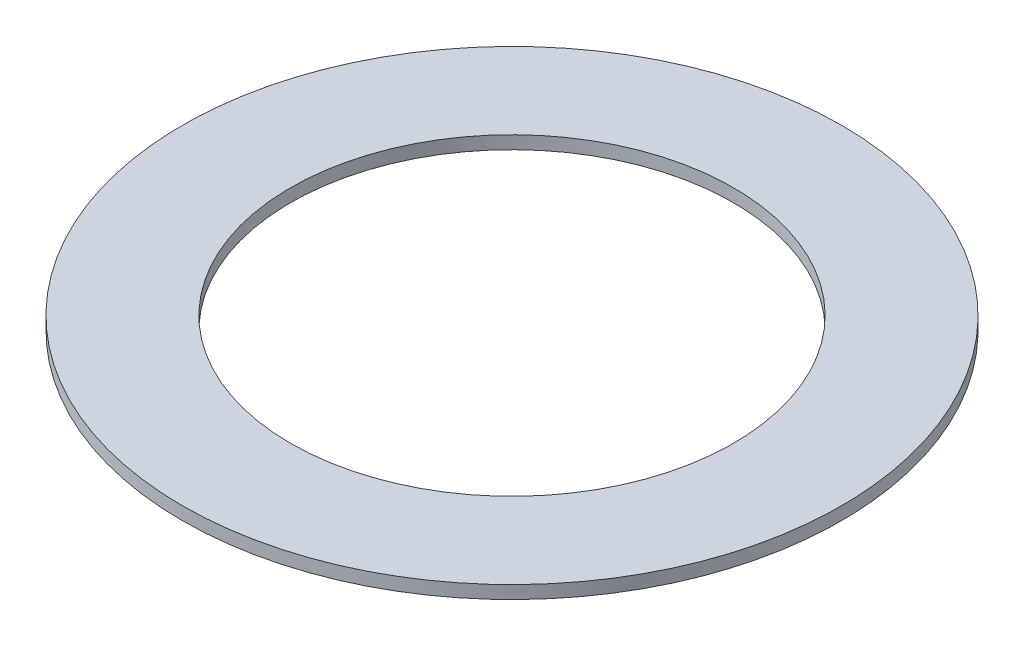
from build123d import *

# Parameters (mm, degrees)
BOSS_EXTRUDE1_DEPTH      = 1.5
BOSS_EXTRUDE1_DEPTH_BACK = 1.5
SKETCH1_R                = 76.2
SKETCH1_R_2              = 51.2


with BuildPart() as part:
    # Sketch1 → Boss-Extrude1 (new, two sides: drawn at the far end of the back side and taken through both)
    with BuildSketch(Plane(origin=(0, 0, 0), x_dir=(1, 0, 0), z_dir=(0, 1, 0)).offset(-BOSS_EXTRUDE1_DEPTH_BACK)):
        Circle(SKETCH1_R)
        Circle(SKETCH1_R_2, mode=Mode.SUBTRACT)
    extrude(amount=BOSS_EXTRUDE1_DEPTH + BOSS_EXTRUDE1_DEPTH_BACK)


solid = part.part
